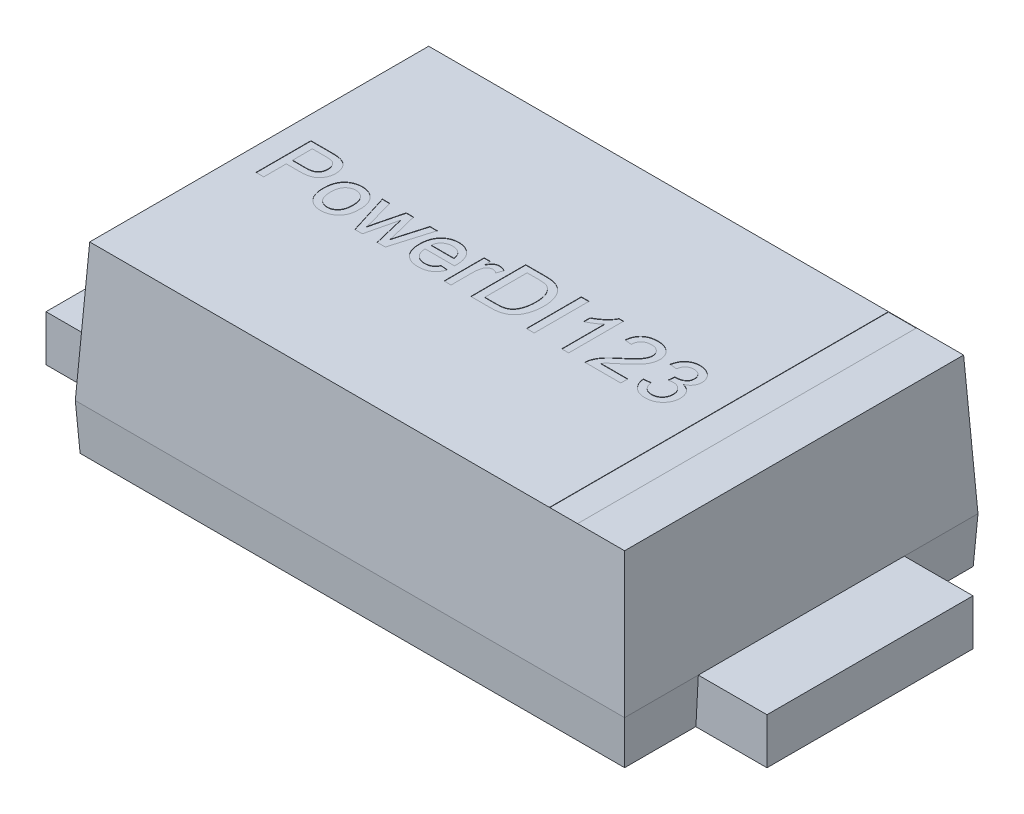
from build123d import *

# Parameters (mm, degrees)
SKETCH1_W                = 3
SKETCH1_H                = 1.93
BOSS_EXTRUDE1_DEPTH      = 0.75
BOSS_EXTRUDE1_TAPER      = 3
SKETCH5_W                = 3
SKETCH5_H                = 1.93
BOSS_EXTRUDE3_DEPTH      = 0.25
BOSS_EXTRUDE3_TAPER      = 3
BOSS_EXTRUDE4_DEPTH      = 0.001
BOSS_EXTRUDE4_DEPTH_BACK = 0.25
SKETCH6_W                = 0.775
SKETCH6_H                = 1.25
SKETCH7_W                = 0.153635287
SKETCH7_H                = 1.851388332
SKETCH7_W_2              = 0.042307692
SKETCH7_H_2              = 0.3
CUT_EXTRUDE1_DEPTH       = 0.002


with BuildPart() as part:
    # Sketch1 → Boss-Extrude1 (new body)
    with BuildSketch(Plane(origin=(0, 0.25, 0), x_dir=(1, 0, 0), z_dir=(0, 1, 0))):
        Rectangle(SKETCH1_W, SKETCH1_H)
    extrude(amount=BOSS_EXTRUDE1_DEPTH, taper=BOSS_EXTRUDE1_TAPER)

    # Sketch5 → Boss-Extrude3 (add)
    with BuildSketch(Plane.XZ.offset(-0.25)):
        Rectangle(SKETCH5_W, SKETCH5_H)
    extrude(amount=BOSS_EXTRUDE3_DEPTH, taper=BOSS_EXTRUDE3_TAPER)

    # Sketch6 → Boss-Extrude4 (add, two sides: drawn at the far end of the back side and taken through both)
    with BuildSketch(Plane.XZ.offset(-BOSS_EXTRUDE4_DEPTH_BACK)):
        Polygon((0.025, -0.625), (1.225, -0.625), (1.225, -0.5625), (1.875, -0.5625), (1.875, 0.5625), (1.225, 0.5625), (1.225, 0.625), (0.025, 0.625), align=None)
        with Locations((-1.6125, 0)):
            Rectangle(SKETCH6_W, SKETCH6_H)
    extrude(amount=BOSS_EXTRUDE4_DEPTH + BOSS_EXTRUDE4_DEPTH_BACK)

    # Sketch7 → Cut-Extrude1 (cut)
    # profile 1 of 11: a face of its own
    with BuildSketch(Plane(origin=(0, 1, 0), x_dir=(1, 0, 0), z_dir=(0, 1, 0))):
        with Locations((1.127135398, 0)):
            Rectangle(SKETCH7_W, SKETCH7_H)
    # profile 2 of 11: a face of its own
    with BuildSketch(Plane(origin=(0, 1, 0), x_dir=(1, 0, 0), z_dir=(0, 1, 0))):
        with BuildLine():
            Line((-1.335405662, -0.142760741), (-1.335405662, 0.157239259))
            Line((-1.335405662, 0.157239259), (-1.225189316, 0.157239259))
            add(Edge.make_bspline(
                [(-1.225189316, 0.157239259), (-1.220620937, 0.157213232), (-1.212041501, 0.157164354), (-1.200060428, 0.156591933), (-1.189772086, 0.155883753), (-1.183557886, 0.154875489), (-1.180718162, 0.154414739)],
                knots=[0, 0, 0, 0, 1.22865052, 2.30741144, 3.226532197, 4, 4, 4, 4], degree=3))
            add(Edge.make_bspline(
                [(-1.180718162, 0.154414739), (-1.177254385, 0.153748128), (-1.170540619, 0.152456048), (-1.161034968, 0.149341126), (-1.152374769, 0.145464842), (-1.144573556, 0.140635393), (-1.137501727, 0.134961971), (-1.131260065, 0.12816388), (-1.125727302, 0.12039291), (-1.121022764, 0.111655139), (-1.117106957, 0.102253302), (-1.11436431, 0.092237092), (-1.11260764, 0.081780528), (-1.112422739, 0.074634271), (-1.112328739, 0.071001278)],
                knots=[0, 0, 0, 0, 1.070909925, 2.075721949, 3.031861647, 3.947440733, 4.85625699, 5.777986723, 6.742441087, 7.747548058, 8.78749499, 9.830146138, 10.896896232, 12, 12, 12, 12], degree=3))
            add(Edge.make_bspline(
                [(-1.112328739, 0.071001278), (-1.112394984, 0.067892891), (-1.112525326, 0.061776968), (-1.113644546, 0.052791796), (-1.115409799, 0.044147695), (-1.118042913, 0.035903818), (-1.121261965, 0.027963786), (-1.125318715, 0.02046151), (-1.130055854, 0.013295115), (-1.135490823, 0.006484101), (-1.14188929, 0.00016668), (-1.149587433, -0.00519241), (-1.158436831, -0.009692539), (-1.168439547, -0.013328595), (-1.1795713, -0.016189585), (-1.191868564, -0.018285791), (-1.205355292, -0.019443072), (-1.214730417, -0.019601514), (-1.219600374, -0.019683818)],
                knots=[0, 0, 0, 0, 0.928769099, 1.82740408, 2.702266355, 3.562020322, 4.410419678, 5.259600434, 6.10654066, 6.975254961, 7.860221694, 8.783881459, 9.766664779, 10.81996744, 11.958551584, 13.197863772, 14.544415867, 16, 16, 16, 16], degree=3))
            Line((-1.219600374, -0.019683818), (-1.29309797, -0.019683818))
            Line((-1.29309797, -0.019683818), (-1.29309797, -0.142760741))
            Line((-1.29309797, -0.142760741), (-1.335405662, -0.142760741))
        make_face()
        with BuildLine():
            Line((-1.29309797, 0.014931566), (-1.220742201, 0.014931566))
            add(Edge.make_bspline(
                [(-1.220742201, 0.014931566), (-1.217856368, 0.014979818), (-1.21229708, 0.015072772), (-1.204264161, 0.015721451), (-1.196891924, 0.016844286), (-1.190159918, 0.018410311), (-1.184059572, 0.020356835), (-1.178601801, 0.022818652), (-1.173814747, 0.025771742), (-1.169666692, 0.029186012), (-1.166106055, 0.033010827), (-1.163020847, 0.037183489), (-1.160399488, 0.041733817), (-1.158344652, 0.046680848), (-1.156603923, 0.051928354), (-1.155517394, 0.057585063), (-1.154761933, 0.063568944), (-1.154678852, 0.067693432), (-1.154636431, 0.069799355)],
                knots=[0, 0, 0, 0, 1.403696362, 2.704090955, 3.91683431, 5.027708188, 6.063065288, 7.026749679, 7.932587242, 8.790956304, 9.632005367, 10.468072405, 11.310475089, 12.179234342, 13.069796908, 13.994719932, 14.976123913, 16, 16, 16, 16], degree=3))
            add(Edge.make_bspline(
                [(-1.154636431, 0.069799355), (-1.154726051, 0.072853279), (-1.154899701, 0.078770717), (-1.156649274, 0.087285728), (-1.159392234, 0.095153749), (-1.163319346, 0.102225814), (-1.168072294, 0.108429899), (-1.173659283, 0.113505861), (-1.179901193, 0.117563906), (-1.1845617, 0.119170694), (-1.186908066, 0.119979643)],
                knots=[0, 0, 0, 0, 1.143156811, 2.215038775, 3.243253804, 4.254666983, 5.233799895, 6.158487526, 7.072877374, 8, 8, 8, 8], degree=3))
            add(Edge.make_bspline(
                [(-1.186908066, 0.119979643), (-1.18776738, 0.120189764), (-1.189634729, 0.120646373), (-1.192727979, 0.12116463), (-1.196312891, 0.121655373), (-1.200406942, 0.121980959), (-1.204972795, 0.122304306), (-1.210024407, 0.122453362), (-1.215573287, 0.122582103), (-1.219440015, 0.122609525), (-1.221463355, 0.122623874)],
                knots=[0, 0, 0, 0, 0.611063981, 1.327884044, 2.165719042, 3.110592661, 4.16481496, 5.328235826, 6.601947678, 8, 8, 8, 8], degree=3))
            Line((-1.221463355, 0.122623874), (-1.29309797, 0.122623874))
            Line((-1.29309797, 0.122623874), (-1.29309797, 0.014931566))
        make_face(mode=Mode.SUBTRACT)
    # profile 3 of 11: a face of its own
    with BuildSketch(Plane(origin=(0, 1, 0), x_dir=(1, 0, 0), z_dir=(0, 1, 0))):
        with BuildLine():
            add(Edge.make_bspline(
                [(-1.077713355, -0.033145357), (-1.077605655, -0.028273794), (-1.077397248, -0.018846964), (-1.075904872, -0.005167909), (-1.073346302, 0.007531646), (-1.069755699, 0.019263626), (-1.065112339, 0.030031729), (-1.059376054, 0.039775539), (-1.05270505, 0.048674066), (-1.047381208, 0.05370391), (-1.044720566, 0.056217624)],
                knots=[0, 0, 0, 0, 1.189940866, 2.302622481, 3.356378305, 4.350088409, 5.294652018, 6.213657312, 7.107257627, 8, 8, 8, 8], degree=3))
            add(Edge.make_bspline(
                [(-1.044720566, 0.056217624), (-1.042393483, 0.058149436), (-1.037781779, 0.061977812), (-1.030254621, 0.06683279), (-1.022418012, 0.071004049), (-1.014202704, 0.07446266), (-1.005582735, 0.077105164), (-0.996584945, 0.07893918), (-0.987220836, 0.080137385), (-0.980842142, 0.080255844), (-0.977593162, 0.080316182)],
                knots=[0, 0, 0, 0, 0.994414631, 1.970684744, 2.940793954, 3.912782355, 4.898970837, 5.902128985, 6.931451948, 8, 8, 8, 8], degree=3))
            add(Edge.make_bspline(
                [(-0.977593162, 0.080316182), (-0.974004182, 0.080214924), (-0.966981677, 0.080016795), (-0.956676529, 0.078724779), (-0.94691826, 0.076323753), (-0.937581222, 0.073176963), (-0.9288068, 0.068983338), (-0.920456404, 0.063983677), (-0.912734504, 0.05792449), (-0.905493104, 0.051075726), (-0.898960521, 0.043416554), (-0.893269068, 0.034984605), (-0.888449222, 0.025852718), (-0.884467763, 0.016012237), (-0.881414398, 0.005456281), (-0.879286124, -0.005792589), (-0.877922737, -0.017707128), (-0.877784268, -0.02588989), (-0.877713355, -0.030080453)],
                knots=[0, 0, 0, 0, 1.026363227, 2.008269884, 2.962742747, 3.895658536, 4.820662428, 5.738204837, 6.673158329, 7.621267452, 8.584296177, 9.545483285, 10.524327568, 11.531652541, 12.575780624, 13.660990097, 14.802144351, 16, 16, 16, 16], degree=3))
            add(Edge.make_bspline(
                [(-0.877713355, -0.030080453), (-0.877740073, -0.033486934), (-0.877791984, -0.040105272), (-0.878419469, -0.049748761), (-0.879367694, -0.058832883), (-0.88065825, -0.067367977), (-0.882396691, -0.075340359), (-0.884564551, -0.082743625), (-0.887078622, -0.089617761), (-0.88996809, -0.095970102), (-0.893265093, -0.101851964), (-0.896856928, -0.10739012), (-0.900833889, -0.112576168), (-0.905190876, -0.117401515), (-0.909869095, -0.121901154), (-0.914900466, -0.126092145), (-0.920294277, -0.129914151), (-0.927909261, -0.134554576), (-0.937960094, -0.139417239), (-0.950689976, -0.143584438), (-0.963970621, -0.146124321), (-0.973014737, -0.146444706), (-0.977593162, -0.146606895)],
                knots=[0, 0, 0, 0, 1.174068422, 2.28105775, 3.329581501, 4.321819531, 5.255045276, 6.14001734, 6.978936381, 7.776151739, 8.542754425, 9.301196708, 10.049767304, 10.792968067, 11.540167917, 12.285482871, 13.048063169, 13.816653646, 15.357768987, 16.884132754, 18.422646949, 20, 20, 20, 20], degree=3))
            add(Edge.make_bspline(
                [(-0.977593162, -0.146606895), (-0.981242847, -0.146507911), (-0.988386302, -0.146314171), (-0.998837199, -0.144992307), (-1.008755739, -0.142727284), (-1.018112001, -0.139426518), (-1.026989375, -0.135374671), (-1.035303971, -0.130316569), (-1.043071855, -0.124362422), (-1.050224425, -0.117473818), (-1.056764267, -0.109804249), (-1.062346851, -0.101189034), (-1.067124862, -0.091805868), (-1.071028487, -0.081614283), (-1.074010313, -0.070613973), (-1.07615163, -0.058833896), (-1.077505151, -0.046257858), (-1.077642685, -0.037596047), (-1.077713355, -0.033145357)],
                knots=[0, 0, 0, 0, 1.022681766, 2.001674804, 2.94671416, 3.868132449, 4.777362857, 5.676573364, 6.589418535, 7.514523194, 8.454681358, 9.407574523, 10.384198733, 11.400667853, 12.460217505, 13.573389442, 14.753137007, 16, 16, 16, 16], degree=3))
        make_face()
        with BuildLine():
            add(Edge.make_bspline(
                [(-1.039251816, -0.033025165), (-1.039186544, -0.036231638), (-1.039060287, -0.042434021), (-1.038306773, -0.051436556), (-1.036930244, -0.059794322), (-1.035015175, -0.067537685), (-1.032558872, -0.074667742), (-1.0295484, -0.081196564), (-1.0260166, -0.087129687), (-1.021886837, -0.092370386), (-1.017392247, -0.097002583), (-1.012544458, -0.10099822), (-1.007410887, -0.104391013), (-1.001982811, -0.107157399), (-0.996284809, -0.109343092), (-0.990304485, -0.110916831), (-0.984031234, -0.111820476), (-0.979759487, -0.11193396), (-0.977593162, -0.111991511)],
                knots=[0, 0, 0, 0, 1.36128903, 2.633184439, 3.831299874, 4.953299848, 6.015607462, 7.027679361, 8.000438392, 8.93945591, 9.853536715, 10.73548639, 11.60109037, 12.460616037, 13.316600729, 14.187036799, 15.080594522, 16, 16, 16, 16], degree=3))
            add(Edge.make_bspline(
                [(-0.977593162, -0.111991511), (-0.975445453, -0.111942431), (-0.971207809, -0.111845591), (-0.965016221, -0.110820341), (-0.959057357, -0.109349518), (-0.953380451, -0.107179232), (-0.948032736, -0.104316428), (-0.942910583, -0.10093011), (-0.938117815, -0.096876015), (-0.933571804, -0.092252694), (-0.92950105, -0.086934666), (-0.925849696, -0.081025041), (-0.922849671, -0.07439018), (-0.920424353, -0.067131685), (-0.918488075, -0.059234101), (-0.917117956, -0.050694412), (-0.916368843, -0.041492107), (-0.916240827, -0.03514986), (-0.916174893, -0.031883338)],
                knots=[0, 0, 0, 0, 0.904535546, 1.784739026, 2.638791991, 3.488785886, 4.338695884, 5.191202824, 6.07237792, 6.980061329, 7.919174549, 8.889507933, 9.902165842, 10.981000531, 12.111539881, 13.326270405, 14.622917219, 16, 16, 16, 16], degree=3))
            add(Edge.make_bspline(
                [(-0.916174893, -0.031883338), (-0.916241382, -0.028797157), (-0.916370694, -0.022795038), (-0.917115772, -0.014070543), (-0.918509995, -0.005937792), (-0.920387818, 0.001626141), (-0.922961849, 0.008558968), (-0.9259195, 0.014992124), (-0.929570861, 0.020798016), (-0.933713289, 0.026009393), (-0.938234574, 0.030647179), (-0.943039424, 0.034717313), (-0.948177888, 0.038059843), (-0.953526175, 0.04090155), (-0.959170905, 0.043024839), (-0.965058733, 0.044630965), (-0.971235024, 0.045531612), (-0.975446936, 0.045643688), (-0.977593162, 0.045700797)],
                knots=[0, 0, 0, 0, 1.329905342, 2.586449315, 3.768451236, 4.882143757, 5.938857988, 6.950440627, 7.927559667, 8.885972819, 9.813736587, 10.714405609, 11.592966897, 12.450023853, 13.318821862, 14.185602452, 15.075453733, 16, 16, 16, 16], degree=3))
            add(Edge.make_bspline(
                [(-0.977593162, 0.045700797), (-0.979759303, 0.045642768), (-0.984030687, 0.045528342), (-0.990306579, 0.044631553), (-0.996270385, 0.043034537), (-1.001997422, 0.040944137), (-1.007405456, 0.038151161), (-1.012568757, 0.034776994), (-1.01734989, 0.030705661), (-1.021912472, 0.026145101), (-1.025994856, 0.020903809), (-1.029550694, 0.015030312), (-1.032570848, 0.00854229), (-1.035013417, 0.001426628), (-1.036930753, -0.006315917), (-1.038306658, -0.014673923), (-1.039058512, -0.023656419), (-1.039186071, -0.029838736), (-1.039251816, -0.033025165)],
                knots=[0, 0, 0, 0, 0.920966903, 1.816042154, 2.687956485, 3.542385364, 4.403370762, 5.270444796, 6.159337503, 7.068888003, 8.009500254, 8.976623456, 9.982690403, 11.046802133, 12.170707598, 13.370857791, 14.644913259, 16, 16, 16, 16], degree=3))
        make_face(mode=Mode.SUBTRACT)
    # profile 4 of 11: a face of its own
    with BuildSketch(Plane(origin=(0, 1, 0), x_dir=(1, 0, 0), z_dir=(0, 1, 0))):
        with BuildLine():
            Line((-0.795802297, -0.142760741), (-0.864251816, 0.076470028))
            Line((-0.864251816, 0.076470028), (-0.824227778, 0.076470028))
            Line((-0.824227778, 0.076470028), (-0.787569124, -0.051294395))
            Line((-0.787569124, -0.051294395), (-0.776511431, -0.097147761))
            add(Edge.make_bspline(
                [(-0.776511431, -0.097147761), (-0.776413646, -0.096666466), (-0.776139766, -0.095318451), (-0.775500057, -0.092727396), (-0.774707021, -0.088965922), (-0.773529049, -0.084066185), (-0.772082074, -0.078002381), (-0.770418758, -0.070766203), (-0.768491046, -0.062369241), (-0.767098417, -0.056402096), (-0.766355181, -0.053217472)],
                knots=[0, 0, 0, 0, 0.261394749, 0.732117884, 1.420242552, 2.307348358, 3.414248811, 4.738505606, 6.259362921, 8, 8, 8, 8], degree=3))
            Line((-0.766355181, -0.053217472), (-0.733903258, 0.076470028))
            Line((-0.733903258, 0.076470028), (-0.694119605, 0.076470028))
            Line((-0.694119605, 0.076470028), (-0.66184797, -0.052496318))
            Line((-0.66184797, -0.052496318), (-0.652713355, -0.092580453))
            Line((-0.652713355, -0.092580453), (-0.641295085, -0.050993915))
            Line((-0.641295085, -0.050993915), (-0.604396047, 0.076470028))
            Line((-0.604396047, 0.076470028), (-0.564251816, 0.076470028))
            Line((-0.564251816, 0.076470028), (-0.629215758, -0.142760741))
            Line((-0.629215758, -0.142760741), (-0.673927297, -0.142760741))
            Line((-0.673927297, -0.142760741), (-0.705237393, -0.013734299))
            Line((-0.705237393, -0.013734299), (-0.714251816, 0.025869066))
            Line((-0.714251816, 0.025869066), (-0.754636431, -0.142760741))
            Line((-0.754636431, -0.142760741), (-0.795802297, -0.142760741))
        make_face()
    # profile 5 of 11: a face of its own
    with BuildSketch(Plane(origin=(0, 1, 0), x_dir=(1, 0, 0), z_dir=(0, 1, 0))):
        with BuildLine():
            Line((-0.389672489, -0.077376126), (-0.351992201, -0.08122228))
            add(Edge.make_bspline(
                [(-0.351992201, -0.08122228), (-0.352764796, -0.083763912), (-0.354284642, -0.088763798), (-0.357368417, -0.09585515), (-0.36075707, -0.10259227), (-0.364760695, -0.10882835), (-0.369153643, -0.114696112), (-0.374022956, -0.120148752), (-0.379475071, -0.125048693), (-0.385307329, -0.12960056), (-0.391616775, -0.133600884), (-0.398336897, -0.137132693), (-0.405492303, -0.14004749), (-0.413062569, -0.142475679), (-0.421065002, -0.144327648), (-0.429484754, -0.145607072), (-0.438310715, -0.146513496), (-0.444337518, -0.146575257), (-0.447424893, -0.146606895)],
                knots=[0, 0, 0, 0, 1.017198368, 2.001028156, 2.958938375, 3.904526299, 4.836491671, 5.766019286, 6.700699831, 7.641977538, 8.598163567, 9.559604839, 10.547559217, 11.555094156, 12.60347703, 13.691418688, 14.817373327, 16, 16, 16, 16], degree=3))
            add(Edge.make_bspline(
                [(-0.447424893, -0.146606895), (-0.451295548, -0.146515937), (-0.458842125, -0.146338596), (-0.469862982, -0.144915919), (-0.480273089, -0.142665404), (-0.490095116, -0.13947682), (-0.499266121, -0.13532151), (-0.507809392, -0.130210925), (-0.51577807, -0.124263136), (-0.523057446, -0.117373397), (-0.529643534, -0.10969468), (-0.535268323, -0.101156619), (-0.540146606, -0.091963835), (-0.544026483, -0.081967001), (-0.547093162, -0.07126621), (-0.549220952, -0.05981592), (-0.550582311, -0.047661562), (-0.550719757, -0.039299022), (-0.550790278, -0.035008338)],
                knots=[0, 0, 0, 0, 1.077616366, 2.10101772, 3.089143248, 4.040031729, 4.971276009, 5.886882173, 6.807369977, 7.734796568, 8.672701003, 9.618074947, 10.576315496, 11.565652878, 12.598619221, 13.67195277, 14.805516698, 16, 16, 16, 16], degree=3))
            add(Edge.make_bspline(
                [(-0.550790278, -0.035008338), (-0.550719073, -0.030557827), (-0.550580816, -0.021916291), (-0.549236911, -0.009334231), (-0.547014369, 0.002479096), (-0.543998445, 0.013566551), (-0.540002145, 0.023874572), (-0.535125935, 0.033399402), (-0.529399965, 0.042192611), (-0.522768925, 0.050125438), (-0.515431634, 0.057179656), (-0.507621216, 0.063452412), (-0.499173752, 0.068629108), (-0.490261913, 0.072927159), (-0.480799807, 0.076229353), (-0.470845721, 0.078661256), (-0.460323863, 0.080033513), (-0.453137891, 0.080220627), (-0.449468162, 0.080316182)],
                knots=[0, 0, 0, 0, 1.232307979, 2.392766439, 3.499416159, 4.558769794, 5.570548426, 6.555643267, 7.517416609, 8.470735273, 9.412423306, 10.33263532, 11.239503873, 12.150233765, 13.067967044, 14.009932887, 14.983713455, 16, 16, 16, 16], degree=3))
            add(Edge.make_bspline(
                [(-0.449468162, 0.080316182), (-0.44591756, 0.080224877), (-0.438968929, 0.080046192), (-0.428788949, 0.078612048), (-0.419088659, 0.076370955), (-0.409888424, 0.07311589), (-0.40123455, 0.068843075), (-0.393033572, 0.063743371), (-0.385342782, 0.057669186), (-0.378211502, 0.050703283), (-0.371713845, 0.042923874), (-0.366093274, 0.034300788), (-0.361334049, 0.024955281), (-0.357475984, 0.014815903), (-0.354506188, 0.003941097), (-0.35235465, -0.007676257), (-0.350997788, -0.020032208), (-0.350860733, -0.02853433), (-0.350790278, -0.032904972)],
                knots=[0, 0, 0, 0, 1.005323219, 1.967446859, 2.906060863, 3.821317632, 4.724696067, 5.63467896, 6.55185077, 7.494776645, 8.453732942, 9.416859909, 10.403972786, 11.418730779, 12.484189468, 13.592581733, 14.76243057, 16, 16, 16, 16], degree=3))
            add(Edge.make_bspline(
                [(-0.350790278, -0.032904972), (-0.35080858, -0.034267182), (-0.350852724, -0.037552722), (-0.350927054, -0.040837726), (-0.350970566, -0.042760741)],
                knots=[0, 0, 0, 0, 0.829215456, 2, 2, 2, 2], degree=3))
            Line((-0.350970566, -0.042760741), (-0.512328739, -0.042760741))
            add(Edge.make_bspline(
                [(-0.512328739, -0.042760741), (-0.512106076, -0.045469425), (-0.511670458, -0.050768694), (-0.510400134, -0.058441056), (-0.508685799, -0.065651504), (-0.506378103, -0.072336549), (-0.503651946, -0.078571061), (-0.500282875, -0.084252491), (-0.496529442, -0.089507026), (-0.492216842, -0.094206556), (-0.48756271, -0.098386749), (-0.482582231, -0.102053721), (-0.477284236, -0.105095184), (-0.47174537, -0.107652075), (-0.465913874, -0.109576139), (-0.45981636, -0.110953056), (-0.453418797, -0.111814498), (-0.449050218, -0.111931755), (-0.446823931, -0.111991511)],
                knots=[0, 0, 0, 0, 1.224729154, 2.396059788, 3.502114335, 4.561587772, 5.580251543, 6.563724943, 7.533714888, 8.486186356, 9.43260269, 10.350144711, 11.268619442, 12.181885516, 13.095687177, 14.031096784, 14.996620783, 16, 16, 16, 16], degree=3))
            add(Edge.make_bspline(
                [(-0.446823931, -0.111991511), (-0.443573395, -0.111882677), (-0.437276286, -0.11167184), (-0.428190128, -0.110192663), (-0.419861235, -0.107584578), (-0.412231077, -0.103964214), (-0.405312315, -0.099165128), (-0.399275114, -0.093022386), (-0.393907595, -0.085742135), (-0.391115874, -0.080227381), (-0.389672489, -0.077376126)],
                knots=[0, 0, 0, 0, 1.096312125, 2.123833578, 3.094060441, 4.030938787, 4.962563683, 5.918139224, 6.923629937, 8, 8, 8, 8], degree=3))
        make_face()
        with BuildLine():
            Line((-0.512328739, -0.008145357), (-0.389251816, -0.008145357))
            add(Edge.make_bspline(
                [(-0.389251816, -0.008145357), (-0.389493921, -0.00623972), (-0.389967291, -0.002513782), (-0.390963656, 0.002875322), (-0.392292492, 0.007896308), (-0.39389287, 0.012530318), (-0.395844423, 0.016786223), (-0.398049359, 0.020670553), (-0.400513099, 0.02422479), (-0.402427921, 0.026290366), (-0.403374412, 0.027311374)],
                knots=[0, 0, 0, 0, 1.185316253, 2.317552585, 3.379013743, 4.387694847, 5.339152611, 6.263729899, 7.141766409, 8, 8, 8, 8], degree=3))
            add(Edge.make_bspline(
                [(-0.403374412, 0.027311374), (-0.404886689, 0.028787405), (-0.407873695, 0.031702818), (-0.412853843, 0.035460971), (-0.418206031, 0.038577563), (-0.423826206, 0.041266609), (-0.429840077, 0.043214752), (-0.436127236, 0.044686461), (-0.442775204, 0.045520159), (-0.447322509, 0.045639668), (-0.449648451, 0.045700797)],
                knots=[0, 0, 0, 0, 0.989486767, 1.954405495, 2.91383024, 3.888017634, 4.867526279, 5.869356945, 6.910178459, 8, 8, 8, 8], degree=3))
            add(Edge.make_bspline(
                [(-0.449648451, 0.045700797), (-0.451753596, 0.045651911), (-0.455874272, 0.04555622), (-0.461944935, 0.044882844), (-0.467763278, 0.04376656), (-0.473318988, 0.042110315), (-0.478632358, 0.040097346), (-0.483666029, 0.037524149), (-0.488455233, 0.034534184), (-0.492980898, 0.031114071), (-0.497074958, 0.027281204), (-0.500819029, 0.023198347), (-0.503918744, 0.018685855), (-0.50666711, 0.013953979), (-0.508819099, 0.008855044), (-0.51051324, 0.003464163), (-0.511719204, -0.00223352), (-0.51212375, -0.006157186), (-0.512328739, -0.008145357)],
                knots=[0, 0, 0, 0, 1.10270868, 2.158476208, 3.195774995, 4.201977093, 5.192014471, 6.168217026, 7.158254405, 8.146844603, 9.134487423, 10.093158795, 11.042305272, 11.996428104, 12.955501471, 13.934632866, 14.95345241, 16, 16, 16, 16], degree=3))
        make_face(mode=Mode.SUBTRACT)
    # profile 6 of 11: a face of its own
    with BuildSketch(Plane(origin=(0, 1, 0), x_dir=(1, 0, 0), z_dir=(0, 1, 0))):
        with BuildLine():
            Line((-0.308482585, -0.142760741), (-0.308482585, 0.076470028))
            Line((-0.308482585, 0.076470028), (-0.273867201, 0.076470028))
            Line((-0.273867201, 0.076470028), (-0.273867201, 0.045881085))
            add(Edge.make_bspline(
                [(-0.273867201, 0.045881085), (-0.271930939, 0.049116479), (-0.268343755, 0.055110479), (-0.262686101, 0.063009033), (-0.257302905, 0.069195244), (-0.251868655, 0.073603161), (-0.246430457, 0.076653796), (-0.240877423, 0.078753994), (-0.235067641, 0.080088115), (-0.231105987, 0.080239406), (-0.229095566, 0.080316182)],
                knots=[0, 0, 0, 0, 1.517336028, 2.811068648, 3.907416798, 4.807929446, 5.613162482, 6.406966847, 7.191583018, 8, 8, 8, 8], degree=3))
            add(Edge.make_bspline(
                [(-0.229095566, 0.080316182), (-0.226120067, 0.08018339), (-0.220089085, 0.079914237), (-0.211052656, 0.077848604), (-0.201909311, 0.074716817), (-0.196085699, 0.071625632), (-0.19309797, 0.070039739)],
                knots=[0, 0, 0, 0, 0.943117096, 1.911585642, 2.928565726, 4, 4, 4, 4], degree=3))
            Line((-0.19309797, 0.070039739), (-0.205117201, 0.036686374))
            add(Edge.make_bspline(
                [(-0.205117201, 0.036686374), (-0.207203872, 0.038073766), (-0.211228229, 0.040749492), (-0.217681097, 0.043583373), (-0.22412877, 0.045392092), (-0.228463337, 0.045598934), (-0.23059797, 0.045700797)],
                knots=[0, 0, 0, 0, 1.093324321, 2.108587182, 3.068540977, 4, 4, 4, 4], degree=3))
            add(Edge.make_bspline(
                [(-0.23059797, 0.045700797), (-0.232449618, 0.04560673), (-0.236105629, 0.045420999), (-0.241447515, 0.043978387), (-0.246473298, 0.041594135), (-0.251179104, 0.038341631), (-0.255364421, 0.034230443), (-0.259037806, 0.029422353), (-0.262006258, 0.023832907), (-0.263369387, 0.019742725), (-0.264071528, 0.017635893)],
                knots=[0, 0, 0, 0, 0.946345552, 1.868524143, 2.808299705, 3.780481321, 4.780563855, 5.797153696, 6.865325266, 8, 8, 8, 8], degree=3))
            add(Edge.make_bspline(
                [(-0.264071528, 0.017635893), (-0.264988497, 0.014222839), (-0.266850211, 0.007293348), (-0.26863776, -0.003489172), (-0.269846358, -0.014728194), (-0.269961997, -0.022384724), (-0.270021047, -0.026294395)],
                knots=[0, 0, 0, 0, 0.953038166, 1.934944501, 2.945515915, 4, 4, 4, 4], degree=3))
            Line((-0.270021047, -0.026294395), (-0.270021047, -0.142760741))
            Line((-0.270021047, -0.142760741), (-0.308482585, -0.142760741))
        make_face()
    # profile 7 of 11: a face of its own
    with BuildSketch(Plane(origin=(0, 1, 0), x_dir=(1, 0, 0), z_dir=(0, 1, 0))):
        with BuildLine():
            Line((-0.162328739, -0.142760741), (-0.162328739, 0.157239259))
            Line((-0.162328739, 0.157239259), (-0.059744605, 0.157239259))
            add(Edge.make_bspline(
                [(-0.059744605, 0.157239259), (-0.056940091, 0.157226589), (-0.051490707, 0.157201971), (-0.043574922, 0.157045068), (-0.036162853, 0.156666621), (-0.029288654, 0.156205623), (-0.022917654, 0.155591843), (-0.017057993, 0.154905484), (-0.011705099, 0.154010219), (-0.008339675, 0.153266086), (-0.006739797, 0.152912335)],
                knots=[0, 0, 0, 0, 1.263127796, 2.454354013, 3.565393221, 4.605443485, 5.557051711, 6.447822442, 7.26211484, 8, 8, 8, 8], degree=3))
            add(Edge.make_bspline(
                [(-0.006739797, 0.152912335), (-0.002602235, 0.151826798), (0.00552641, 0.149694153), (0.017000847, 0.144897044), (0.027534879, 0.138879946), (0.033782223, 0.133923586), (0.036890011, 0.131458009)],
                knots=[0, 0, 0, 0, 1.04477941, 2.052571232, 3.03123721, 4, 4, 4, 4], degree=3))
            add(Edge.make_bspline(
                [(0.036890011, 0.131458009), (0.038819618, 0.1297635), (0.042687568, 0.126366813), (0.048000174, 0.120770522), (0.05292859, 0.114833767), (0.057620022, 0.108658754), (0.061774409, 0.102020358), (0.065668564, 0.09510965), (0.06906521, 0.087787854), (0.072191771, 0.080174628), (0.074977324, 0.0722403), (0.077266116, 0.063989992), (0.079368788, 0.055509858), (0.080932687, 0.0467072), (0.08229789, 0.037656684), (0.083164558, 0.028306508), (0.083726881, 0.018684583), (0.083792046, 0.01216798), (0.083825107, 0.008861855)],
                knots=[0, 0, 0, 0, 0.908997367, 1.822109427, 2.728529095, 3.640759027, 4.565643067, 5.499218265, 6.448003669, 7.421473682, 8.413047621, 9.423472075, 10.452328391, 11.505545429, 12.587978234, 13.692612971, 14.829372988, 16, 16, 16, 16], degree=3))
            add(Edge.make_bspline(
                [(0.083825107, 0.008861855), (0.08374452, 0.003329119), (0.083587701, -0.007437456), (0.082036813, -0.023097238), (0.079636946, -0.03781692), (0.076144279, -0.051508115), (0.071842695, -0.064094888), (0.06715004, -0.075680036), (0.061748461, -0.086063938), (0.05582305, -0.095334371), (0.049474129, -0.103549989), (0.04282288, -0.110834096), (0.035849588, -0.117189914), (0.028589674, -0.122784245), (0.020666093, -0.127416505), (0.012161967, -0.131575885), (0.002801398, -0.134917945), (-0.007239339, -0.137841318), (-0.018078177, -0.140031439), (-0.029656421, -0.141640811), (-0.042019577, -0.142614018), (-0.050508032, -0.142710886), (-0.054876816, -0.142760741)],
                knots=[0, 0, 0, 0, 1.410753827, 2.745293735, 4.009435601, 5.211453015, 6.344066657, 7.400119332, 8.396481539, 9.324811333, 10.202671465, 11.041621015, 11.837259285, 12.606727868, 13.374311266, 14.17412185, 15.017911533, 15.905707008, 16.839601966, 17.835295848, 18.885883805, 20, 20, 20, 20], degree=3))
            Line((-0.054876816, -0.142760741), (-0.162328739, -0.142760741))
        make_face()
        with BuildLine():
            Line((-0.120021047, -0.108145357), (-0.058182105, -0.108145357))
            add(Edge.make_bspline(
                [(-0.058182105, -0.108145357), (-0.053672963, -0.108077857), (-0.045142671, -0.107950162), (-0.033107776, -0.106969468), (-0.022604087, -0.105277902), (-0.013515128, -0.102871261), (-0.005629037, -0.099759104), (0.001314704, -0.096079792), (0.007491249, -0.091904599), (0.010970497, -0.08856427), (0.012671261, -0.086931415)],
                knots=[0, 0, 0, 0, 1.423649224, 2.693227144, 3.808972214, 4.778671344, 5.656058397, 6.479437267, 7.256702014, 8, 8, 8, 8], degree=3))
            add(Edge.make_bspline(
                [(0.012671261, -0.086931415), (0.014884466, -0.084400782), (0.01943115, -0.079201992), (0.025092951, -0.070119982), (0.030030317, -0.059900982), (0.034157675, -0.048436205), (0.037542001, -0.035764428), (0.039799218, -0.021772148), (0.041275005, -0.006554508), (0.041434599, 0.004030317), (0.041517415, 0.009522912)],
                knots=[0, 0, 0, 0, 0.782184731, 1.606876467, 2.483531085, 3.422528604, 4.441347086, 5.534669947, 6.720709839, 8, 8, 8, 8], degree=3))
            add(Edge.make_bspline(
                [(0.041517415, 0.009522912), (0.041466103, 0.013349667), (0.041366354, 0.020788722), (0.040744509, 0.031626178), (0.039516894, 0.041768953), (0.03794689, 0.051234589), (0.035803295, 0.059992999), (0.033352057, 0.068128098), (0.030268316, 0.075533539), (0.02674939, 0.082266494), (0.022889087, 0.088371676), (0.018866512, 0.09398022), (0.014661081, 0.099073739), (0.010183683, 0.103579759), (0.005568914, 0.107631535), (0.000730743, 0.111146113), (-0.004317292, 0.114122413), (-0.007864514, 0.115667433), (-0.009624412, 0.11643397)],
                knots=[0, 0, 0, 0, 1.460126857, 2.838427476, 4.139102445, 5.35666337, 6.496721546, 7.577303074, 8.594995104, 9.55219858, 10.472533725, 11.348579167, 12.184287935, 12.989560785, 13.769667798, 14.524891986, 15.268148459, 16, 16, 16, 16], degree=3))
            add(Edge.make_bspline(
                [(-0.009624412, 0.11643397), (-0.010999527, 0.116937202), (-0.013913304, 0.118003519), (-0.018668871, 0.119210429), (-0.023976133, 0.12032112), (-0.029887399, 0.121100681), (-0.036372776, 0.121858329), (-0.043472575, 0.122318736), (-0.051149561, 0.12252738), (-0.056459241, 0.122590993), (-0.059203739, 0.122623874)],
                knots=[0, 0, 0, 0, 0.699400087, 1.48198292, 2.341906832, 3.289648813, 4.329964754, 5.462247508, 6.688271602, 8, 8, 8, 8], degree=3))
            Line((-0.059203739, 0.122623874), (-0.120021047, 0.122623874))
            Line((-0.120021047, 0.122623874), (-0.120021047, -0.108145357))
        make_face(mode=Mode.SUBTRACT)
    # profile 8 of 11: a face of its own
    with BuildSketch(Plane(origin=(0, 1, 0), x_dir=(1, 0, 0), z_dir=(0, 1, 0))):
        with Locations((0.162671261, 0.007239259)):
            Rectangle(SKETCH7_W_2, SKETCH7_H_2)
    # profile 9 of 11: a face of its own
    with BuildSketch(Plane(origin=(0, 1, 0), x_dir=(1, 0, 0), z_dir=(0, 1, 0))):
        with BuildLine():
            Line((0.372286645, -0.142760741), (0.333825107, -0.142760741))
            Line((0.333825107, -0.142760741), (0.333825107, 0.091013297))
            add(Edge.make_bspline(
                [(0.333825107, 0.091013297), (0.331610488, 0.08887757), (0.327007646, 0.084438694), (0.319227027, 0.078156577), (0.310542862, 0.071789386), (0.30106792, 0.065666619), (0.29140982, 0.059902694), (0.282076509, 0.05471893), (0.273223812, 0.050332208), (0.267392493, 0.047933531), (0.264594338, 0.046782528)],
                knots=[0, 0, 0, 0, 0.893362401, 1.856755847, 2.901947673, 4.020460078, 5.132200827, 6.168787962, 7.121294059, 8, 8, 8, 8], degree=3))
            Line((0.264594338, 0.046782528), (0.264594338, 0.082239259))
            add(Edge.make_bspline(
                [(0.264594338, 0.082239259), (0.269400458, 0.08471442), (0.278873036, 0.089592817), (0.292255742, 0.098018479), (0.304749936, 0.107152243), (0.316148792, 0.116992088), (0.32636714, 0.127050176), (0.334978291, 0.137199181), (0.342183553, 0.147067086), (0.34579857, 0.153948855), (0.34752703, 0.157239259)],
                knots=[0, 0, 0, 0, 1.141258006, 2.249351951, 3.335817539, 4.406819942, 5.426913362, 6.360259544, 7.215985427, 8, 8, 8, 8], degree=3))
            Line((0.34752703, 0.157239259), (0.372286645, 0.157239259))
            Line((0.372286645, 0.157239259), (0.372286645, -0.142760741))
        make_face()
    # profile 10 of 11: a face of its own
    with BuildSketch(Plane(origin=(0, 1, 0), x_dir=(1, 0, 0), z_dir=(0, 1, 0))):
        with BuildLine():
            Line((0.65690203, -0.104299203), (0.65690203, -0.142760741))
            Line((0.65690203, -0.142760741), (0.460748184, -0.142760741))
            add(Edge.make_bspline(
                [(0.460748184, -0.142760741), (0.460744168, -0.140474864), (0.46073615, -0.135910771), (0.461508468, -0.129160767), (0.462718073, -0.122500308), (0.464085772, -0.11822922), (0.464774626, -0.116078049)],
                knots=[0, 0, 0, 0, 1.01057331, 2.01775941, 3.001627217, 4, 4, 4, 4], degree=3))
            add(Edge.make_bspline(
                [(0.464774626, -0.116078049), (0.466047399, -0.112563293), (0.468638974, -0.10540667), (0.473889532, -0.095080663), (0.480065429, -0.084817106), (0.486078534, -0.076461122), (0.491585239, -0.069785274), (0.49620333, -0.064562196), (0.501321021, -0.05921576), (0.506934213, -0.053746943), (0.512988884, -0.048120325), (0.519493295, -0.042317142), (0.526524253, -0.036445543), (0.531432597, -0.032553603), (0.533945299, -0.030561222)],
                knots=[0, 0, 0, 0, 1.204657718, 2.452881516, 3.728232997, 5.065887527, 5.768225529, 6.518857853, 7.313994055, 8.154655305, 9.046094665, 9.979688118, 10.965752482, 12, 12, 12, 12], degree=3))
            add(Edge.make_bspline(
                [(0.533945299, -0.030561222), (0.537805431, -0.027312212), (0.54523836, -0.021056037), (0.55573482, -0.011772452), (0.565321627, -0.003152118), (0.573846123, 0.004956054), (0.58137803, 0.012473421), (0.587935031, 0.019382951), (0.593573546, 0.02566308), (0.598224739, 0.031541124), (0.602149094, 0.037091631), (0.605474638, 0.042505809), (0.608246037, 0.04787823), (0.610554242, 0.053191896), (0.612379836, 0.058469528), (0.613624238, 0.063726504), (0.614468149, 0.068910662), (0.614552583, 0.072360258), (0.614594338, 0.074066182)],
                knots=[0, 0, 0, 0, 1.782554561, 3.432421876, 4.950675607, 6.337395053, 7.588547463, 8.709982106, 9.702713005, 10.569305638, 11.356701089, 12.103210377, 12.812277205, 13.490692607, 14.148717897, 14.782152033, 15.397739362, 16, 16, 16, 16], degree=3))
            add(Edge.make_bspline(
                [(0.614594338, 0.074066182), (0.614552578, 0.075752201), (0.614470647, 0.07906008), (0.613693291, 0.08390114), (0.612611149, 0.088563196), (0.610861655, 0.092962321), (0.60877923, 0.097228791), (0.606108018, 0.10122779), (0.603017974, 0.105058984), (0.599480136, 0.108621362), (0.595615988, 0.111963442), (0.591298353, 0.114741522), (0.586810813, 0.117242621), (0.581998551, 0.119253649), (0.576869386, 0.120730382), (0.571460657, 0.121802111), (0.565773222, 0.122481644), (0.561891947, 0.122575745), (0.559906838, 0.122623874)],
                knots=[0, 0, 0, 0, 0.988194508, 1.938783882, 2.870742509, 3.789494954, 4.709148727, 5.651055405, 6.603531303, 7.592354411, 8.592907906, 9.593461401, 10.59787167, 11.603930315, 12.645063138, 13.723588815, 14.835711238, 16, 16, 16, 16], degree=3))
            add(Edge.make_bspline(
                [(0.559906838, 0.122623874), (0.557821536, 0.122575983), (0.553740447, 0.122482258), (0.547774987, 0.121800015), (0.542111818, 0.120757639), (0.536764455, 0.119163937), (0.531739407, 0.117156263), (0.527057141, 0.114629136), (0.522642673, 0.111776466), (0.518635032, 0.108399121), (0.515010976, 0.104654334), (0.511793657, 0.100577394), (0.509157548, 0.096089624), (0.50698054, 0.0912897), (0.505230043, 0.086162534), (0.503959242, 0.080668928), (0.503266393, 0.074824746), (0.503127067, 0.070822651), (0.503055876, 0.06877772)],
                knots=[0, 0, 0, 0, 1.131143733, 2.213731411, 3.253917892, 4.251203413, 5.236093891, 6.184197493, 7.13373276, 8.082770301, 9.020476205, 9.957489029, 10.893177274, 11.836722509, 12.812818608, 13.827831385, 14.890097571, 16, 16, 16, 16], degree=3))
            Line((0.503055876, 0.06877772), (0.464594338, 0.072623874))
            add(Edge.make_bspline(
                [(0.464594338, 0.072623874), (0.464987854, 0.075975891), (0.465753406, 0.082496952), (0.467660291, 0.09194161), (0.470337385, 0.100727849), (0.473540755, 0.108978168), (0.47755648, 0.116552122), (0.482095911, 0.123606368), (0.487449962, 0.129917178), (0.493364767, 0.135683475), (0.49990513, 0.1407651), (0.507009614, 0.145204605), (0.51467497, 0.148917976), (0.522858504, 0.151992493), (0.531579003, 0.154325207), (0.540824132, 0.155997983), (0.550608757, 0.157029101), (0.557320151, 0.157168206), (0.560748184, 0.157239259)],
                knots=[0, 0, 0, 0, 1.130804643, 2.199883102, 3.223565206, 4.205909148, 5.160801384, 6.091796021, 7.01151579, 7.927798993, 8.855738875, 9.7815393, 10.730299821, 11.705391175, 12.706931101, 13.751121791, 14.851322166, 16, 16, 16, 16], degree=3))
            add(Edge.make_bspline(
                [(0.560748184, 0.157239259), (0.564217249, 0.157179855), (0.570975007, 0.157064136), (0.580822148, 0.155880099), (0.590113197, 0.154035971), (0.598882216, 0.151465823), (0.607077396, 0.148095591), (0.61470504, 0.143977929), (0.621800319, 0.139153004), (0.628244685, 0.133562894), (0.634055738, 0.127460354), (0.639148269, 0.120947627), (0.64340587, 0.114052537), (0.647030953, 0.106869069), (0.64971981, 0.09924544), (0.651610665, 0.091285296), (0.652895555, 0.082981833), (0.653001725, 0.077316362), (0.653055876, 0.074426759)],
                knots=[0, 0, 0, 0, 1.195390245, 2.328627238, 3.413424916, 4.457841177, 5.473507151, 6.462241215, 7.441013641, 8.425227782, 9.397253344, 10.342087291, 11.269524934, 12.186751184, 13.110685745, 14.048630397, 15.004728144, 16, 16, 16, 16], degree=3))
            add(Edge.make_bspline(
                [(0.653055876, 0.074426759), (0.652973189, 0.071458018), (0.652807632, 0.065513987), (0.651515435, 0.056629412), (0.649304473, 0.047841256), (0.646373327, 0.039042559), (0.642368771, 0.030198401), (0.637309695, 0.021186776), (0.631033358, 0.011974396), (0.624997282, 0.00414285), (0.619378675, -0.002421961), (0.61439831, -0.007825184), (0.608636317, -0.013565747), (0.602308849, -0.019842459), (0.595157841, -0.026432546), (0.587388758, -0.033533353), (0.578831532, -0.040958013), (0.57289115, -0.046030184), (0.569822703, -0.048650165)],
                knots=[0, 0, 0, 0, 0.927118007, 1.856282007, 2.79721255, 3.754929441, 4.749232485, 5.824981375, 6.979078785, 8.228161913, 8.911614355, 9.677694854, 10.522803217, 11.452009355, 12.461436787, 13.560019032, 14.739651695, 16, 16, 16, 16], degree=3))
            add(Edge.make_bspline(
                [(0.569822703, -0.048650165), (0.567195042, -0.050789361), (0.562184497, -0.054868478), (0.555056026, -0.060782085), (0.548671085, -0.066204701), (0.542880361, -0.070959453), (0.53789475, -0.075276321), (0.533538641, -0.078966245), (0.529970293, -0.082214754), (0.524536331, -0.087149305), (0.517653754, -0.094183008), (0.512582378, -0.10101746), (0.510147222, -0.104299203)],
                knots=[0, 0, 0, 0, 1.241996727, 2.368296581, 3.394949853, 4.3125351, 5.114548721, 5.812230366, 6.404953749, 6.883082049, 8.503329734, 10, 10, 10, 10], degree=3))
            Line((0.510147222, -0.104299203), (0.65690203, -0.104299203))
        make_face()
    # profile 11 of 11: a face of its own
    with BuildSketch(Plane(origin=(0, 1, 0), x_dir=(1, 0, 0), z_dir=(0, 1, 0))):
        with BuildLine():
            Line((0.699209722, -0.061991511), (0.737671261, -0.058145357))
            add(Edge.make_bspline(
                [(0.737671261, -0.058145357), (0.738183999, -0.060456354), (0.73917611, -0.064927962), (0.741085052, -0.071334004), (0.743101314, -0.077280244), (0.745600863, -0.082633679), (0.748039879, -0.087613241), (0.750906092, -0.09201318), (0.753968696, -0.095948295), (0.757284309, -0.099403976), (0.760891137, -0.102379739), (0.764741093, -0.104983692), (0.7689156, -0.107158344), (0.773382697, -0.108880138), (0.77810476, -0.110273945), (0.783107452, -0.111297392), (0.788417225, -0.111907072), (0.792056644, -0.111962905), (0.793921261, -0.111991511)],
                knots=[0, 0, 0, 0, 1.321063709, 2.556160278, 3.730472002, 4.821700466, 5.852032229, 6.822994757, 7.746964065, 8.632786469, 9.490489437, 10.352773447, 11.223141997, 12.11199479, 13.021433979, 13.96892724, 14.959401504, 16, 16, 16, 16], degree=3))
            add(Edge.make_bspline(
                [(0.793921261, -0.111991511), (0.796108391, -0.111960328), (0.800379859, -0.111899427), (0.806604094, -0.110985682), (0.81252755, -0.109731024), (0.818065717, -0.107763648), (0.82329571, -0.105359151), (0.828187733, -0.102387702), (0.832775273, -0.098898478), (0.836967843, -0.094867744), (0.840717248, -0.090433808), (0.84405662, -0.085750441), (0.846817832, -0.080777679), (0.849145117, -0.075585567), (0.850862959, -0.070090201), (0.852120557, -0.064360107), (0.852942404, -0.058369371), (0.853017533, -0.054281924), (0.853055876, -0.052195838)],
                knots=[0, 0, 0, 0, 1.111377895, 2.170522867, 3.193923215, 4.186422864, 5.152846954, 6.117443035, 7.091571248, 8.078879332, 9.069127402, 10.041602243, 10.999610288, 11.957618333, 12.930786866, 13.922135183, 14.939532534, 16, 16, 16, 16], degree=3))
            add(Edge.make_bspline(
                [(0.853055876, -0.052195838), (0.853010812, -0.050210608), (0.852922647, -0.046326665), (0.852197861, -0.04062587), (0.850933125, -0.035214278), (0.849179898, -0.03006057), (0.846939635, -0.025172312), (0.844246904, -0.020509083), (0.840953473, -0.016173077), (0.837246426, -0.012117723), (0.83320312, -0.008381578), (0.828778342, -0.005203506), (0.824121813, -0.002460726), (0.819178037, -0.000246038), (0.813967542, 0.001511772), (0.808495294, 0.002775144), (0.802734984, 0.003500245), (0.798811132, 0.003588425), (0.796805876, 0.003633489)],
                knots=[0, 0, 0, 0, 1.072815875, 2.098878726, 3.09954706, 4.07199174, 5.036203424, 6.001873089, 6.97636515, 7.972747947, 8.969130744, 9.945905975, 10.911575641, 11.885646534, 12.868345115, 13.879560892, 14.916365174, 16, 16, 16, 16], degree=3))
            add(Edge.make_bspline(
                [(0.796805876, 0.003633489), (0.79504037, 0.003586715), (0.791293556, 0.003487451), (0.785379828, 0.002610979), (0.778829373, 0.001383713), (0.774302822, 0.000179333), (0.771926069, -0.000453049)],
                knots=[0, 0, 0, 0, 0.837610211, 1.777604146, 2.833088267, 4, 4, 4, 4], degree=3))
            Line((0.771926069, -0.000453049), (0.775892415, 0.034162335))
            add(Edge.make_bspline(
                [(0.775892415, 0.034162335), (0.776933091, 0.034048618), (0.778771608, 0.033847718), (0.780619397, 0.033773758), (0.781421261, 0.033741662)],
                knots=[0, 0, 0, 0, 1.132082448, 2, 2, 2, 2], degree=3))
            add(Edge.make_bspline(
                [(0.781421261, 0.033741662), (0.784958449, 0.033876711), (0.791897299, 0.034141633), (0.802012799, 0.036342919), (0.811599325, 0.039808771), (0.819005536, 0.043944037), (0.824497732, 0.047833478), (0.827961, 0.051340361), (0.831083315, 0.055061873), (0.833412818, 0.059330581), (0.835425364, 0.063866187), (0.836671628, 0.06884736), (0.837580507, 0.07415302), (0.837640466, 0.077827864), (0.837671261, 0.07971522)],
                knots=[0, 0, 0, 0, 1.557468908, 3.055264441, 4.54122591, 6.035034992, 6.780215604, 7.498173296, 8.201377046, 8.913174237, 9.633083494, 10.382644491, 11.169345745, 12, 12, 12, 12], degree=3))
            add(Edge.make_bspline(
                [(0.837671261, 0.07971522), (0.83764284, 0.081239701), (0.837587256, 0.084221155), (0.836968028, 0.088592283), (0.835943901, 0.09273406), (0.834559691, 0.096690711), (0.832745546, 0.100441499), (0.830495865, 0.103981832), (0.827925527, 0.107383529), (0.824891334, 0.110470812), (0.821641977, 0.113369313), (0.818058965, 0.115810445), (0.814312823, 0.117979032), (0.810271432, 0.119617731), (0.806034564, 0.12096501), (0.801566004, 0.121909128), (0.796864119, 0.122543167), (0.79364299, 0.122596593), (0.791998184, 0.122623874)],
                knots=[0, 0, 0, 0, 1.041493611, 2.036867705, 3.009952345, 3.954088258, 4.897230656, 5.850851638, 6.817653571, 7.805463921, 8.805067469, 9.788883576, 10.763797054, 11.758134544, 12.762883247, 13.799594994, 14.876406454, 16, 16, 16, 16], degree=3))
            add(Edge.make_bspline(
                [(0.791998184, 0.122623874), (0.78877934, 0.122498366), (0.782563274, 0.122255991), (0.773663636, 0.120013523), (0.765598956, 0.116384918), (0.759628256, 0.112129577), (0.755388534, 0.10806123), (0.75249258, 0.104612837), (0.749902312, 0.100804806), (0.747610391, 0.096638493), (0.74564778, 0.092097144), (0.743878541, 0.087237019), (0.742508986, 0.081980307), (0.741853541, 0.078337924), (0.741517415, 0.076470028)],
                knots=[0, 0, 0, 0, 1.533565899, 2.961543033, 4.347411787, 5.731829577, 6.434842101, 7.147085226, 7.87612511, 8.629021686, 9.412189982, 10.234506416, 11.094615066, 12, 12, 12, 12], degree=3))
            Line((0.741517415, 0.076470028), (0.703055876, 0.080316182))
            add(Edge.make_bspline(
                [(0.703055876, 0.080316182), (0.70365753, 0.08329007), (0.70483772, 0.089123585), (0.707242152, 0.097548771), (0.710174327, 0.105457621), (0.713694895, 0.112813876), (0.717637535, 0.119705571), (0.722185656, 0.126050961), (0.727232627, 0.13188777), (0.732787414, 0.137198194), (0.738774606, 0.141940998), (0.745164048, 0.146032288), (0.751903304, 0.149500246), (0.758998684, 0.152296033), (0.76644457, 0.154569432), (0.774262145, 0.156075565), (0.782416025, 0.157094388), (0.787968484, 0.157190374), (0.790796261, 0.157239259)],
                knots=[0, 0, 0, 0, 1.136581168, 2.229493434, 3.279335563, 4.293305329, 5.282068175, 6.250623624, 7.213783178, 8.169396253, 9.125981663, 10.071280146, 11.007896369, 11.961295906, 12.925420184, 13.920544621, 14.940967302, 16, 16, 16, 16], degree=3))
            add(Edge.make_bspline(
                [(0.790796261, 0.157239259), (0.794710577, 0.157112327), (0.802407389, 0.156862738), (0.813712212, 0.154880475), (0.824525215, 0.151627541), (0.834759388, 0.147118395), (0.844238656, 0.141608337), (0.852627027, 0.135004869), (0.85981236, 0.127422228), (0.865655095, 0.118943315), (0.870281722, 0.109915807), (0.873705287, 0.100544861), (0.875750918, 0.090841266), (0.876005247, 0.084271935), (0.876132799, 0.080977239)],
                knots=[0, 0, 0, 0, 1.104647871, 2.172094857, 3.229560912, 4.285649672, 5.322588163, 6.317201348, 7.289435229, 8.260615662, 9.214246199, 10.146367077, 11.070353327, 12, 12, 12, 12], degree=3))
            add(Edge.make_bspline(
                [(0.876132799, 0.080977239), (0.876003486, 0.077862773), (0.875748164, 0.071713409), (0.873782486, 0.06272195), (0.87046088, 0.054203554), (0.865971316, 0.046128332), (0.860149453, 0.03867092), (0.853011282, 0.032025686), (0.844670995, 0.026129045), (0.838420656, 0.023059908), (0.835207319, 0.021482047)],
                knots=[0, 0, 0, 0, 0.975609618, 1.926294443, 2.868398979, 3.832526731, 4.812148358, 5.820404151, 6.879456693, 8, 8, 8, 8], degree=3))
            add(Edge.make_bspline(
                [(0.835207319, 0.021482047), (0.837361647, 0.020938122), (0.841581347, 0.019872731), (0.847641793, 0.017665271), (0.853339293, 0.015080892), (0.858749676, 0.012153777), (0.86371587, 0.00869199), (0.868409054, 0.004906918), (0.872651815, 0.00061627), (0.876567073, -0.004027028), (0.880129478, -0.008974384), (0.883127276, -0.014322033), (0.885714289, -0.019929397), (0.887920248, -0.025837145), (0.889505445, -0.03209083), (0.89063891, -0.038642005), (0.891386905, -0.045467909), (0.891473485, -0.050130553), (0.891517415, -0.052496318)],
                knots=[0, 0, 0, 0, 1.053251915, 2.063013066, 3.05373318, 4.018979697, 4.975584284, 5.920798056, 6.874756953, 7.832116109, 8.799604348, 9.761196922, 10.734637845, 11.72654167, 12.747371341, 13.789206138, 14.878271633, 16, 16, 16, 16], degree=3))
            add(Edge.make_bspline(
                [(0.891517415, -0.052496318), (0.891444212, -0.055726158), (0.891300346, -0.062073828), (0.88993649, -0.0713987), (0.887707644, -0.080333181), (0.884623219, -0.088907611), (0.880714766, -0.097156984), (0.875810301, -0.104964886), (0.870055182, -0.112394786), (0.863539382, -0.119375545), (0.8564007, -0.125791078), (0.848648364, -0.131346315), (0.840435755, -0.136063911), (0.831749506, -0.139911086), (0.822612646, -0.142933636), (0.813016084, -0.145100297), (0.802930125, -0.146373665), (0.796048324, -0.146528129), (0.792539049, -0.146606895)],
                knots=[0, 0, 0, 0, 1.016055063, 1.996874249, 2.958724482, 3.910019225, 4.860394196, 5.826121543, 6.806008102, 7.814207964, 8.82789325, 9.821757317, 10.810247154, 11.803791187, 12.806673825, 13.834534493, 14.895752369, 16, 16, 16, 16], degree=3))
            add(Edge.make_bspline(
                [(0.792539049, -0.146606895), (0.789389767, -0.146547576), (0.783189899, -0.146430795), (0.774114574, -0.145214143), (0.76541994, -0.143487575), (0.757174751, -0.140825861), (0.74928323, -0.137579945), (0.741879032, -0.133427285), (0.734829024, -0.128660191), (0.728265561, -0.123142468), (0.722225093, -0.117052344), (0.716836272, -0.110479898), (0.712208856, -0.103439721), (0.708128881, -0.096037149), (0.704831206, -0.088132639), (0.702263444, -0.079794057), (0.700305491, -0.071052349), (0.699578953, -0.065044653), (0.699209722, -0.061991511)],
                knots=[0, 0, 0, 0, 1.08471039, 2.135426191, 3.150939737, 4.135689946, 5.116584603, 6.086901885, 7.055842759, 8.045878862, 9.036901429, 10.008421467, 10.96965771, 11.936653536, 12.917548193, 13.915472582, 14.940632654, 16, 16, 16, 16], degree=3))
        make_face()
    extrude(amount=-CUT_EXTRUDE1_DEPTH, mode=Mode.SUBTRACT)


solid = part.part
